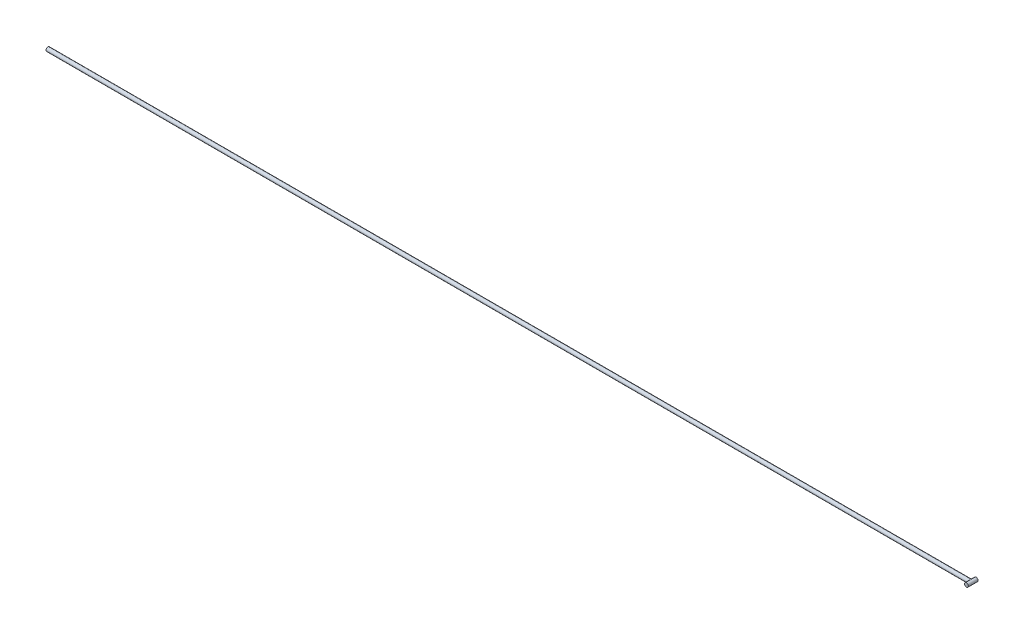
from build123d import *

# Parameters (mm, degrees)
BALAYAGE1_PROFILE_R = 1
BALAYAGE2_PROFILE_R = 1


with BuildPart() as part:
    # Balayage1: sweep along a path in Esquisse1
    with BuildLine(Plane.XY) as balayage1_path:
        Line((-239, 0), (239, 0))
    # Balayage1 profile (on start of the path) → Balayage1 (sweep)
    with BuildSketch(Plane(origin=(-239, 0, 0), x_dir=(0, 0, 1), z_dir=(1, 0, 0))):
        Circle(BALAYAGE1_PROFILE_R)
    sweep(path=balayage1_path.line)

    # Balayage2: sweep along a path in Esquisse16
    with BuildLine(Plane(origin=(239, 0, 0), x_dir=(0, 0, -1), z_dir=(1, 0, 0))) as balayage2_path:
        Line((-2.5, 0), (2.5, 0))
    # Balayage2 profile (on start of the path) → Balayage2 (sweep)
    with BuildSketch(Plane(origin=(239, 0, 2.5), x_dir=(-1, 0, 0), z_dir=(0, 0, -1))):
        Circle(BALAYAGE2_PROFILE_R)
    sweep(path=balayage2_path.line)


solid = part.part
